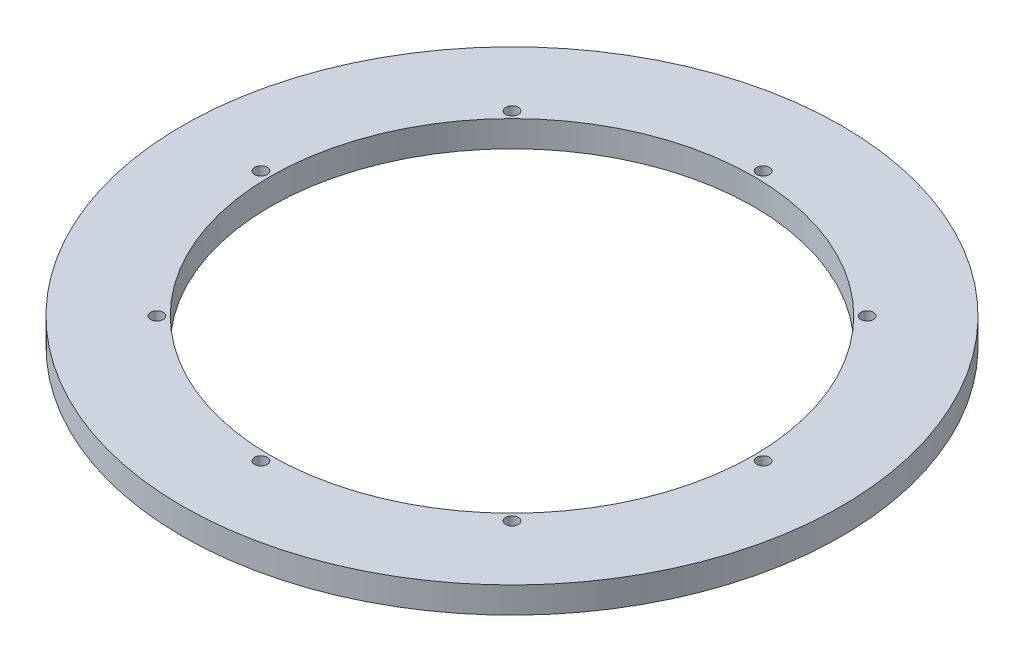
from build123d import *

# Parameters (mm, degrees)
SKETCH1_R           = 315
SKETCH1_R_2         = 231
SKETCH1_R_3         = 6
BOSS_EXTRUDE1_DEPTH = 12.5


with BuildPart() as part:
    # Sketch1 → Boss-Extrude1 (new, symmetric)
    with BuildSketch(Plane(origin=(0, 0, 0), x_dir=(1, 0, 0), z_dir=(0, 1, 0))):
        with Locations(Location((0, 0, 0), (0, 0, 270))):
            Circle(SKETCH1_R)
        with Locations(Location((0, 0, 0), (0, 0, 270))):
            Circle(SKETCH1_R_2, mode=Mode.SUBTRACT)
        with Locations(Location((0, 240, 0), (0, 0, 270))):
            Circle(SKETCH1_R_3, mode=Mode.SUBTRACT)
        with Locations(Location((169.705627485, 169.705627485, 0), (0, 0, 270))):
            Circle(SKETCH1_R_3, mode=Mode.SUBTRACT)
        with Locations(Location((240, 0, 0), (0, 0, 270))):
            Circle(SKETCH1_R_3, mode=Mode.SUBTRACT)
        with Locations(Location((169.705627485, -169.705627485, 0), (0, 0, 270))):
            Circle(SKETCH1_R_3, mode=Mode.SUBTRACT)
        with Locations(Location((0, -240, 0), (0, 0, 270))):
            Circle(SKETCH1_R_3, mode=Mode.SUBTRACT)
        with Locations(Location((-169.705627485, -169.705627485, 0), (0, 0, 270))):
            Circle(SKETCH1_R_3, mode=Mode.SUBTRACT)
        with Locations(Location((-240, 0, 0), (0, 0, 270))):
            Circle(SKETCH1_R_3, mode=Mode.SUBTRACT)
        with Locations(Location((-169.705627485, 169.705627485, 0), (0, 0, 270))):
            Circle(SKETCH1_R_3, mode=Mode.SUBTRACT)
    extrude(amount=BOSS_EXTRUDE1_DEPTH, both=True)


solid = part.part
